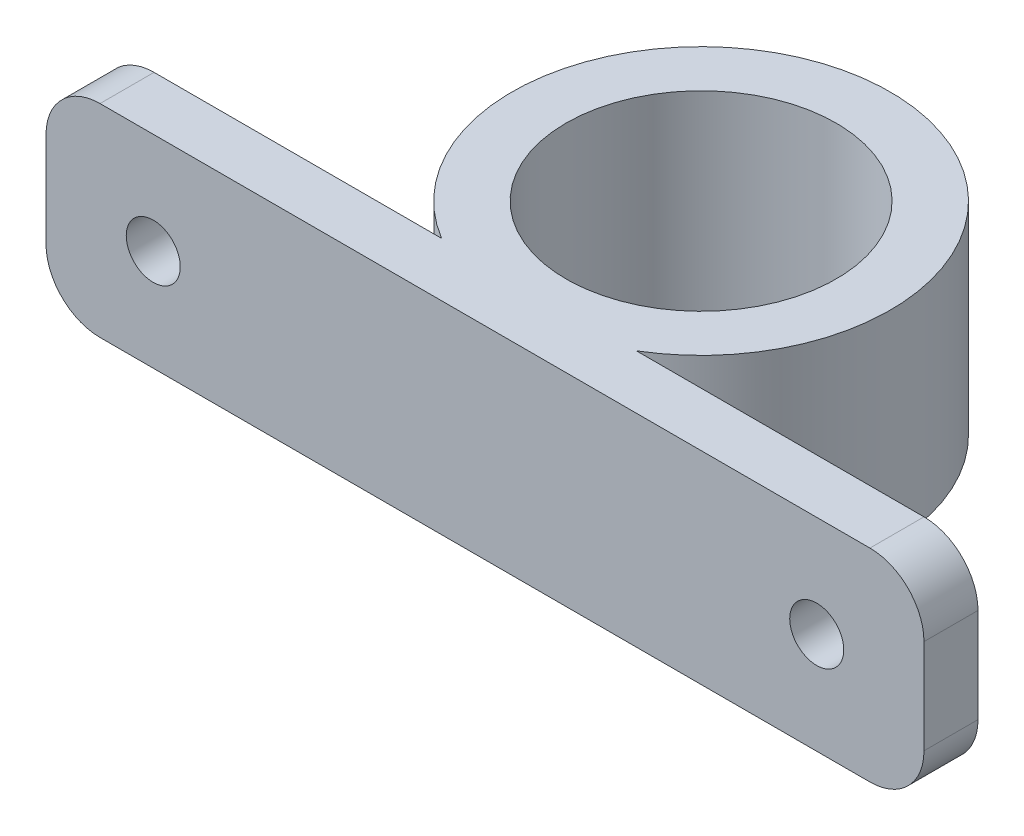
from build123d import *

# Parameters (mm, degrees)
SKETCH1_W           = 32.5
SKETCH1_H           = 7.5
BOSS_EXTRUDE1_DEPTH = 2
SKETCH2_R           = 7
SKETCH2_R_2         = 5
BOSS_EXTRUDE2_DEPTH = 7.5
SKETCH3_R           = 1
CUT_EXTRUDE1_DEPTH  = 3.18
FILLET1_R           = 2


with BuildPart() as part:
    # Sketch1 → Boss-Extrude1 (new body)
    with BuildSketch(Plane.XY):
        Rectangle(SKETCH1_W, SKETCH1_H)
    extrude(amount=BOSS_EXTRUDE1_DEPTH)

    # Sketch2 → Boss-Extrude2 (add)
    with BuildSketch(Plane(origin=(0, 3.75, 0), x_dir=(1, 0, 0), z_dir=(0, 1, 0))):
        with Locations((0, 6)):
            Circle(SKETCH2_R)
        with Locations(Location((0, 6, 0), (0, 0, 180))):
            Circle(SKETCH2_R_2, mode=Mode.SUBTRACT)
    extrude(amount=-BOSS_EXTRUDE2_DEPTH)

    # Sketch3 → Cut-Extrude1 (cut)
    with BuildSketch(Plane(origin=(0, 0, 0), x_dir=(-1, 0, 0), z_dir=(0, 0, -1))):
        with Locations((-12.28, 0)):
            Circle(SKETCH3_R)
        with Locations((12.28, 0)):
            Circle(SKETCH3_R)
    extrude(amount=-CUT_EXTRUDE1_DEPTH, mode=Mode.SUBTRACT)

    # Fillet1
    fillet1_edges = [part.edges().sort_by_distance(p)[0] for p in [
        (-16.25, 3.75, 1),
        (16.25, 3.75, 1),
        (16.25, -3.75, 1),
        (-16.25, -3.75, 1),
    ]]
    fillet(fillet1_edges, radius=FILLET1_R)


solid = part.part
